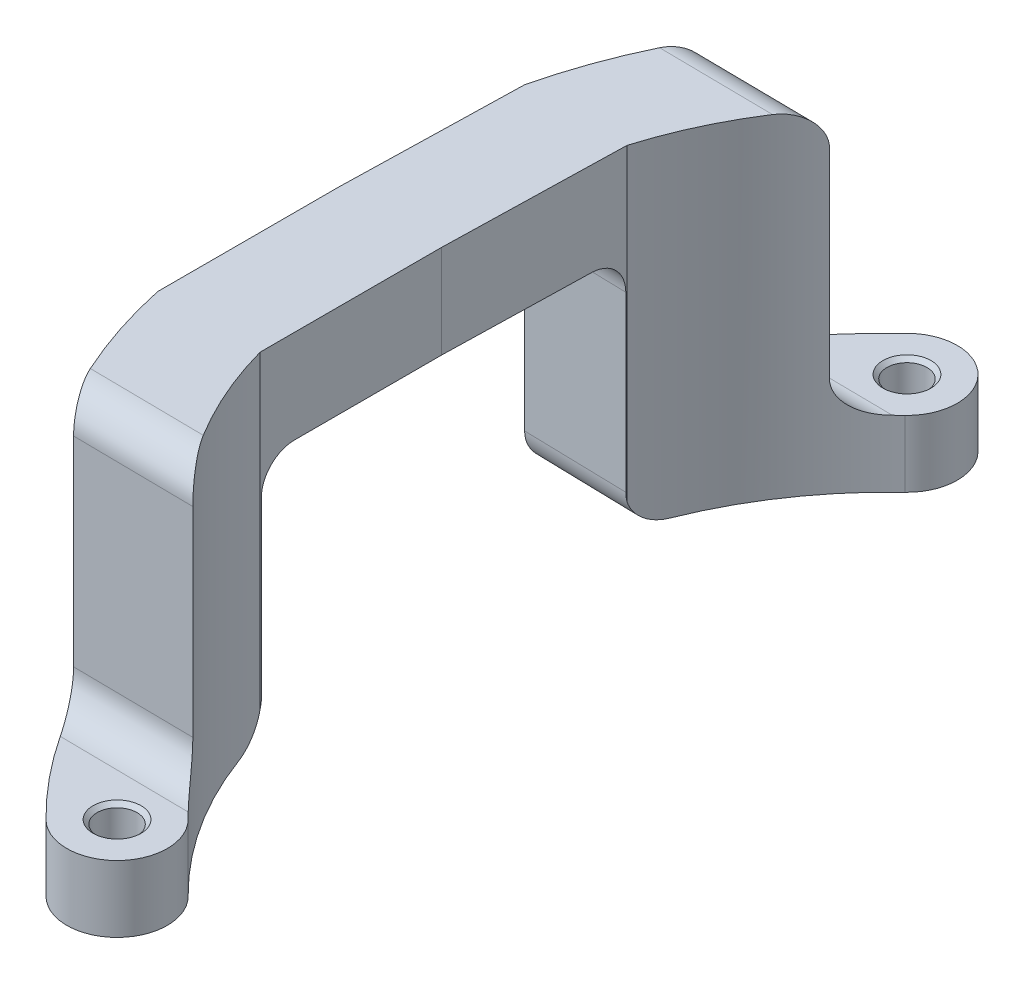
from build123d import *

# Parameters (mm, degrees)
CROQUIS2_R                                           = 1.5000000000000007
SALIENTE_EXTRUIR1_DEPTH                              = 5
SALIENTE_EXTRUIR2_DEPTH                              = 25
AVELLANADO_PARA_TORNILLO_CON_CABEZA_PLAN_D           = 1.8
AVELLANADO_PARA_TORNILLO_CON_CABEZA_PLAN_CSINK_D     = 3.6
AVELLANADO_PARA_TORNILLO_CON_CABEZA_PLAN_CSINK_ANGLE = 90
SALIENTE_EXTRUIR3_DEPTH                              = 25
CORTAR_EXTRUIR3_REACH                                = 53.752
CROQUIS13_W                                          = 29.905861654600464
CROQUIS13_H                                          = 18
CORTAR_EXTRUIR7_DEPTH                                = 57.075529812190766
CORTAR_EXTRUIR7_DEPTH_BACK                           = 16.3
CROQUIS44_W                                          = 16.299999999999983
CROQUIS44_H                                          = 7.0000000000000036
CORTAR_EXTRUIR8_DEPTH                                = 1
REDONDEO1_R                                          = 2.5


with BuildPart() as part:
    # Croquis2 → Saliente-Extruir1 (new body)
    with BuildSketch(Plane(origin=(0, 0, 0), x_dir=(1, 0, 0), z_dir=(0, 1, 0))):
        with BuildLine():
            Line((4.439129900634949, 2.118516979293595), (-4.614530320763677, 2.2280379015268346))
            ThreePointArc((-4.614530320763688, 2.2280379015268323), (-1.7200044543519404, -2.2420294069801585), (1.789858261170167, -6.247106865918674))
            ThreePointArc((1.7898582611701688, -6.247106865918663), (7.12266646558417, -6.2115073036702295), (7.087066903335739, -0.8786990992562278))
            ThreePointArc((7.087066903335739, -0.8786990992562309), (5.711774187433154, 0.574565767125705), (4.439129900634946, 2.118516979293595))
        make_face()
        with Locations((4.438462582252952, -3.5629029825874476)):
            Circle(CROQUIS2_R, mode=Mode.SUBTRACT)
    extrude(amount=SALIENTE_EXTRUIR1_DEPTH)

    # Croquis2<3> → Saliente-Extruir2 (add)
    with BuildSketch(Plane(origin=(0, 0, 0), x_dir=(1, 0, 0), z_dir=(0, 1, 0))):
        with BuildLine():
            ThreePointArc((-8.348947802254838, 12.273944296748217), (-6.849717496148568, 7.114200545347133), (-4.614530320763688, 2.2280379015268323))
            Line((-4.614530320763677, 2.2280379015268346), (4.439129900634949, 2.118516979293595))
            ThreePointArc((4.439129900634946, 2.118516979293595), (1.4480092130333588, 6.906303569503548), (-0.566904192020619, 12.179805951348676))
            Line((-0.5669041920206155, 12.179805951348678), (-8.348947802254829, 12.273944296748219))
        make_face()
    extrude(amount=SALIENTE_EXTRUIR2_DEPTH)

    # Avellanado para tornillo con cabeza plana avellanada de M1.61 (through all)
    with Locations(Plane(origin=(0, 5, 0), x_dir=(1, 0, 0), z_dir=(0, 1, 0))):
        with Locations((4.438462582, -3.562902983)):
            CounterSinkHole(AVELLANADO_PARA_TORNILLO_CON_CABEZA_PLAN_D / 2, AVELLANADO_PARA_TORNILLO_CON_CABEZA_PLAN_CSINK_D / 2, counter_sink_angle=AVELLANADO_PARA_TORNILLO_CON_CABEZA_PLAN_CSINK_ANGLE)

    # Croquis8 → Saliente-Extruir3 (add)
    with BuildSketch(Plane(origin=(0, 0, 0), x_dir=(1, 0, 0), z_dir=(0, 1, 0))):
        Polygon((-8.348947802254834, 42.17980595134868), (-0.5669041920206199, 42.085667605949155), (-0.5669041920206147, 12.179805951348678), (-8.348947802254829, 12.273944296748219), align=None)
    extrude(amount=SALIENTE_EXTRUIR3_DEPTH)

    # Croquis13 → Cortar-Extruir3 (cut, up to next)
    with BuildSketch(Plane.ZY.offset(8.348947802254827), mode=Mode.PRIVATE) as cortar_extruir3_sk1:
        with Locations((-27.22687512404845, 9)):
            Rectangle(CROQUIS13_W, CROQUIS13_H)
    cortar_extruir3_tool1 = extrude(cortar_extruir3_sk1.sketch, amount=-CORTAR_EXTRUIR3_REACH, mode=Mode.PRIVATE) & part.part
    add(cortar_extruir3_tool1.solids().sort_by_distance((-8.348948, 9, -27.226875))[0], mode=Mode.SUBTRACT)

    # Croquis42 → Cortar-Extruir7 (cut, two sides: drawn at the far end of the back side and taken through both)
    with BuildSketch(Plane(origin=(0.5089472836094107, 0, -42.072653173894544), x_dir=(-0.9999268409353232, 0, -0.012095981857829284), z_dir=(0.012095981857829284, 0, -0.9999268409353232)).offset(-CORTAR_EXTRUIR7_DEPTH_BACK)):
        Polygon((1.0759301896763651, 88.39893602181824), (1.0759301896763651, 25), (1.0759301896763651, 18), (8.85854316859686, 18), (72.2574791904151, 18), (161.42014152905733, 108.15386846652605), (90.2385925283186, 178.5528044883443), align=None)
    extrude(amount=CORTAR_EXTRUIR7_DEPTH + CORTAR_EXTRUIR7_DEPTH_BACK, mode=Mode.SUBTRACT)

    # Croquis44 → Cortar-Extruir8 (cut)
    with BuildSketch(Plane(origin=(-1.0758514756300315, 0, -0.01301443205461614), x_dir=(-0.012095981857829285, 0, 0.9999268409353232), z_dir=(-0.9999268409353232, 0, -0.012095981857829285))):
        with Locations((-33.92573139504898, 21.5)):
            Rectangle(CROQUIS44_W, CROQUIS44_H)
    extrude(amount=-CORTAR_EXTRUIR8_DEPTH, mode=Mode.SUBTRACT)

    # Redondeo1
    redondeo1_edges = [part.edges().sort_by_distance(p)[0] for p in [
        (-4.457925997137721, 0, -12.273944296748217),
        (-4.457925997137721, 18, -12.273944296748217),
        (-0.08770021006436401, 25, -2.1732774404102146),
        (-0.08770021006436401, 5, -2.1732774404102146),
    ]]
    fillet(redondeo1_edges, radius=REDONDEO1_R)

    # Simetría1: part across plane


with BuildPart() as part_1:
    add(part.part)
    add(part.part.mirror(Plane(origin=(-8.546112306537452, 25, -25.88099844410291), x_dir=(0.9999268409353231, 0, 0.012095981857829284), z_dir=(-0.012095981857829282, 0, 0.9999268409353232))))


solid = part_1.part
